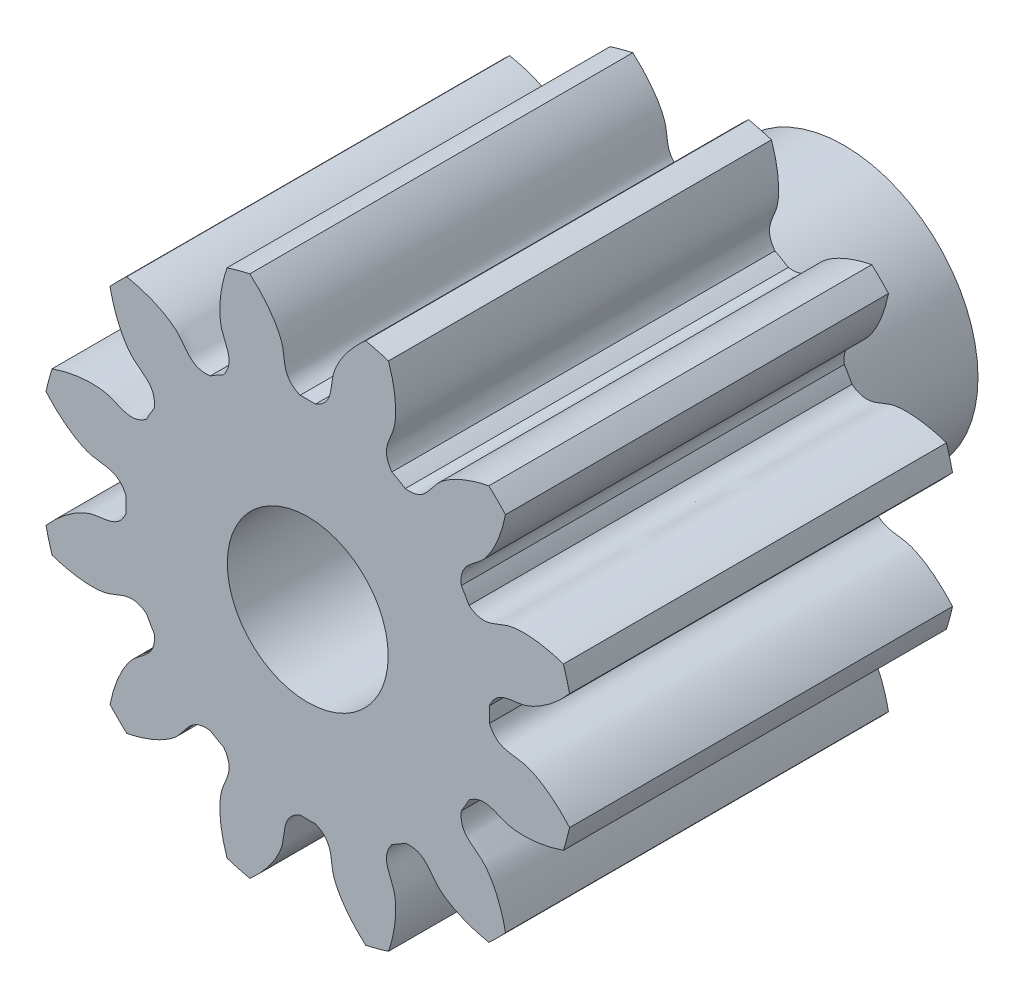
from build123d import *

# Parameters (mm, degrees)
SKETCH_1_R               = 3.5
EXTRUDE_1_DEPTH          = 5
CUT_EXTRUDE_1_DEPTH      = 8.03562364
PATTERN_CIRCULAR_1_COUNT = 12
SKETCH_4_R               = 1.75
EXTRUDE_2_DEPTH          = 2
CUT_EXTRUDE_2_REACH      = 10.506
SKETCH_5_R               = 1.05


with BuildPart() as part:
    # 草图1 → 凸台-拉伸1 (new body)
    with BuildSketch(Plane.XY):
        Circle(SKETCH_1_R)
    extrude(amount=EXTRUDE_1_DEPTH)

    # 草图2 → 切除-拉伸1 (cut, through all)
    with BuildSketch(Plane.XY):
        with BuildLine():
            ThreePointArc((0.100420056, 2.372876063), (0, 2.375), (-0.100420056, 2.372876063))
            add(Edge.make_bspline(
                [(-0.100420056, 2.372876063), (-0.340394435, 2.474653731), (-0.287186739, 2.672409341), (-0.338076094, 2.844740289), (-0.341311927, 2.854952869), (-0.345113625, 2.866166713), (-0.349521434, 2.878363044), (-0.354576313, 2.891521619), (-0.360318258, 2.905621034), (-0.36678678, 2.920638648), (-0.374020716, 2.936550626), (-0.382058239, 2.95333195), (-0.390936819, 2.970956436), (-0.400693193, 2.989396753), (-0.411363332, 3.008624444), (-0.422982412, 3.02860994), (-0.435584786, 3.049322589), (-0.449203949, 3.07073067), (-0.463872517, 3.092801417), (-0.479622192, 3.115501045), (-0.496483738, 3.138794769), (-0.514486952, 3.162646832), (-0.533660639, 3.187020528), (-0.554032585, 3.211878226), (-0.575629533, 3.237181399), (-0.598477155, 3.262890651), (-0.622600033, 3.288965742), (-0.648021632, 3.315365616), (-0.674764279, 3.342048434), (-0.702849139, 3.368971597), (-0.732296196, 3.396091781), (-0.763124233, 3.423364967), (-0.795350811, 3.450746465), (-0.828992247, 3.478190957), (-0.864063604, 3.505652518), (-0.900578664, 3.533084654), (-0.938549918, 3.560440334), (-0.977988547, 3.587672024), (-1.01890441, 3.614731718), (-1.061306025, 3.641570973), (-1.10520056, 3.668140947), (-1.150593819, 3.694392428), (-1.197490231, 3.720275872), (-1.245892835, 3.74574144), (-1.295803277, 3.770739031), (-1.347221796, 3.79521832), (-1.400147219, 3.819128792), (-1.454576948, 3.842419781), (-1.510506963, 3.865040505), (-1.567931802, 3.886940103), (-1.647189853, 3.915363979), (-1.7077968, 3.935050704), (-1.748802701, 3.947485455)],
                knots=[0, 0, 0, 0, 0.218015236, 0.222043642, 0.226545979, 0.231522246, 0.236972443, 0.24289657, 0.249294627, 0.256166614, 0.263512532, 0.271332379, 0.279626157, 0.288393865, 0.297635503, 0.307351072, 0.31754057, 0.328203999, 0.339341357, 0.350952646, 0.363037866, 0.375597015, 0.388630094, 0.402137104, 0.416118043, 0.430572913, 0.445501713, 0.460904444, 0.476781104, 0.493131694, 0.509956215, 0.527254666, 0.545027047, 0.563273358, 0.581993599, 0.601187771, 0.620855872, 0.640997904, 0.661613866, 0.682703758, 0.704267581, 0.726305333, 0.748817015, 0.771802628, 0.795262171, 0.819195644, 0.843603047, 0.868484381, 0.893839644, 0.919668838, 0.945971962, 1, 1, 1, 1], degree=3))
            ThreePointArc((-1.748802701, 3.947485455), (0, 4.317516914), (1.748802701, 3.947485455))
            add(Edge.make_bspline(
                [(0.100420056, 2.372876063), (0.340394435, 2.474653731), (0.287186739, 2.672409341), (0.338076094, 2.844740289), (0.341311927, 2.854952869), (0.345113625, 2.866166713), (0.349521434, 2.878363044), (0.354576313, 2.891521619), (0.360318258, 2.905621034), (0.36678678, 2.920638648), (0.374020716, 2.936550626), (0.382058239, 2.95333195), (0.390936819, 2.970956436), (0.400693193, 2.989396753), (0.411363332, 3.008624444), (0.422982412, 3.02860994), (0.435584786, 3.049322589), (0.449203949, 3.07073067), (0.463872517, 3.092801417), (0.479622192, 3.115501045), (0.496483738, 3.138794769), (0.514486952, 3.162646832), (0.533660639, 3.187020528), (0.554032585, 3.211878226), (0.575629533, 3.237181399), (0.598477155, 3.262890651), (0.622600033, 3.288965742), (0.648021632, 3.315365616), (0.674764279, 3.342048434), (0.702849139, 3.368971597), (0.732296196, 3.396091781), (0.763124233, 3.423364967), (0.795350811, 3.450746465), (0.828992247, 3.478190957), (0.864063604, 3.505652518), (0.900578664, 3.533084654), (0.938549918, 3.560440334), (0.977988547, 3.587672024), (1.01890441, 3.614731718), (1.061306025, 3.641570973), (1.10520056, 3.668140947), (1.150593819, 3.694392428), (1.197490231, 3.720275872), (1.245892835, 3.74574144), (1.295803277, 3.770739031), (1.347221796, 3.79521832), (1.400147219, 3.819128792), (1.454576948, 3.842419781), (1.510506963, 3.865040505), (1.567931802, 3.886940103), (1.647189853, 3.915363979), (1.7077968, 3.935050704), (1.748802701, 3.947485455)],
                knots=[0, 0, 0, 0, 0.218015236, 0.222043642, 0.226545979, 0.231522246, 0.236972443, 0.24289657, 0.249294627, 0.256166614, 0.263512532, 0.271332379, 0.279626157, 0.288393865, 0.297635503, 0.307351072, 0.31754057, 0.328203999, 0.339341357, 0.350952646, 0.363037866, 0.375597015, 0.388630094, 0.402137104, 0.416118043, 0.430572913, 0.445501713, 0.460904444, 0.476781104, 0.493131694, 0.509956215, 0.527254666, 0.545027047, 0.563273358, 0.581993599, 0.601187771, 0.620855872, 0.640997904, 0.661613866, 0.682703758, 0.704267581, 0.726305333, 0.748817015, 0.771802628, 0.795262171, 0.819195644, 0.843603047, 0.868484381, 0.893839644, 0.919668838, 0.945971962, 1, 1, 1, 1], degree=3))
        make_face()
    cut_extrude_1 = extrude(amount=CUT_EXTRUDE_1_DEPTH, mode=Mode.SUBTRACT)

    # 阵列(圆周)1: 切除-拉伸1 ×12 about axis
    pattern_circular_1_axis = Axis((0, 0, 5), (0, 0, -1))
    for i in range(1, PATTERN_CIRCULAR_1_COUNT):
        add(cut_extrude_1.rotate(pattern_circular_1_axis, i * 360 / PATTERN_CIRCULAR_1_COUNT), mode=Mode.SUBTRACT)

    # 草图4 → 凸台-拉伸2 (add)
    with BuildSketch(Plane(origin=(0, 0, 0), x_dir=(-1, 0, 0), z_dir=(0, 0, -1))):
        Circle(SKETCH_4_R)
    extrude(amount=EXTRUDE_2_DEPTH)

    # 草图5 → 切除-拉伸2 (cut, up to next)
    with BuildSketch(Plane(origin=(0, 0, -2), x_dir=(-1, 0, 0), z_dir=(0, 0, -1)), mode=Mode.PRIVATE) as cut_extrude_2_sk1:
        Circle(SKETCH_5_R)
    cut_extrude_2_tool1 = extrude(cut_extrude_2_sk1.sketch, amount=-CUT_EXTRUDE_2_REACH, mode=Mode.PRIVATE) & part.part
    add(cut_extrude_2_tool1.solids().sort_by_distance((0, 0, -2))[0], mode=Mode.SUBTRACT)


solid = part.part
